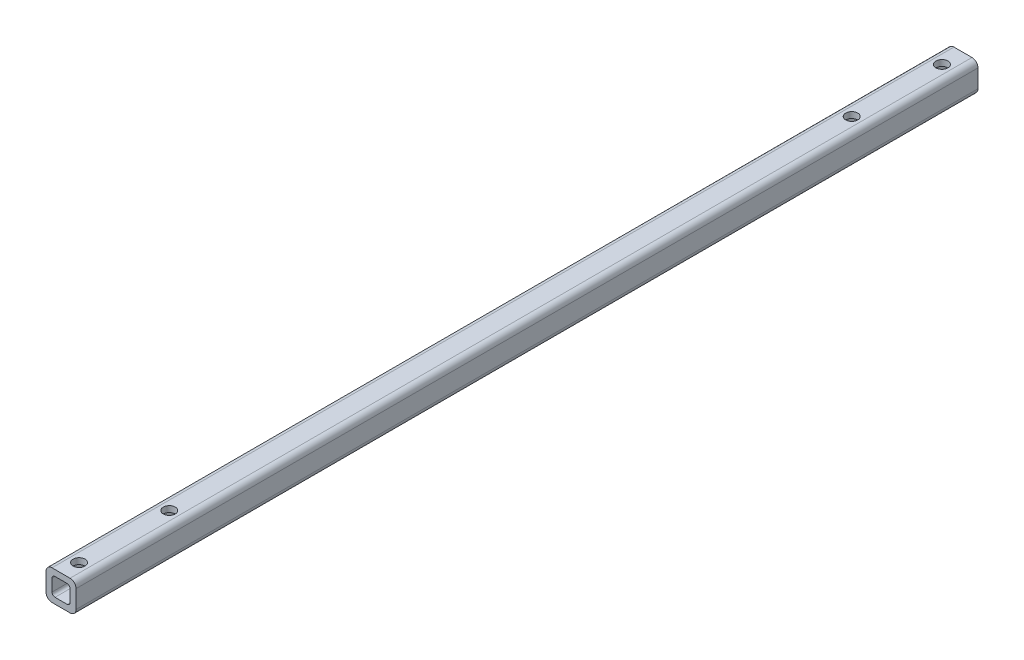
from build123d import *

# Parameters (mm, degrees)
BOSS_EXTRU_1_DEPTH      = 300
ESQUISSE2_R             = 2
ENL_V_MAT_EXTRU_1_DEPTH = 301.333148354


with BuildPart() as part:
    # Esquisse1 → Boss.-Extru.1 (new body)
    with BuildSketch(Plane.XY):
        with BuildLine():
            Line((2, 0), (8, 0))
            ThreePointArc((8, 0), (9.414213562, 0.585786438), (10, 2))
            Line((10, 2), (10, 8))
            ThreePointArc((10, 8), (9.414213562, 9.414213562), (8, 10))
            Line((8, 10), (2, 10))
            ThreePointArc((2, 10), (0.585786438, 9.414213562), (0, 8))
            Line((0, 8), (0, 2))
            ThreePointArc((0, 2), (0.585786438, 0.585786438), (2, 0))
        make_face()
        with BuildLine():
            Line((3, 8), (7, 8))
            ThreePointArc((7, 8), (7.707106781, 7.707106781), (8, 7))
            Line((8, 7), (8, 3))
            ThreePointArc((8, 3), (7.707106781, 2.292893219), (7, 2))
            Line((7, 2), (3, 2))
            ThreePointArc((3, 2), (2.292893219, 2.292893219), (2, 3))
            Line((2, 3), (2, 7))
            ThreePointArc((2, 7), (2.292893219, 7.707106781), (3, 8))
        make_face(mode=Mode.SUBTRACT)
    extrude(amount=BOSS_EXTRU_1_DEPTH)

    # Esquisse2 → Enlèv. mat.-Extru.1 (cut, through all)
    with BuildSketch(Plane(origin=(0, 10, 0), x_dir=(1, 0, 0), z_dir=(0, 1, 0))):
        with Locations(Location((5, -294, 0), (0, 0, 270))):
            Circle(ESQUISSE2_R)
        with Locations(Location((5, -264, 0), (0, 0, 270))):
            Circle(ESQUISSE2_R)
        with Locations(Location((5, -7, 0), (0, 0, 270))):
            Circle(ESQUISSE2_R)
        with Locations(Location((5, -37, 0), (0, 0, 270))):
            Circle(ESQUISSE2_R)
    extrude(amount=-ENL_V_MAT_EXTRU_1_DEPTH, mode=Mode.SUBTRACT)


solid = part.part
